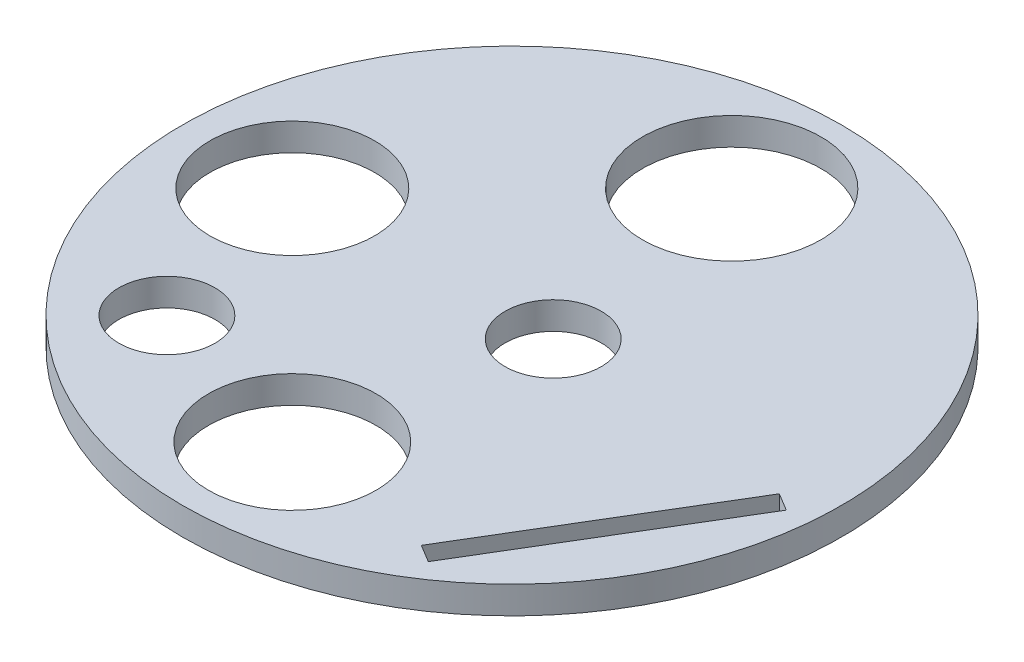
from build123d import *

# Parameters (mm, degrees)
ESQUISSE1_R        = 24
ESQUISSE1_R_2      = 6.5
ESQUISSE1_R_3      = 6
ESQUISSE1_R_4      = 6.1
ESQUISSE1_R_5      = 3.5
BOSS_EXTRU_1_DEPTH = 2


with BuildPart() as part:
    # Esquisse1 → Boss.-Extru.1 (new body)
    with BuildSketch(Plane(origin=(0, 0, 0), x_dir=(1, 0, 0), z_dir=(0, 1, 0))):
        with Locations(Location((0, 0, 0), (0, 0, 270))):
            Circle(ESQUISSE1_R)
        with Locations(Location((0, 16, 0), (0, 0, 270))):
            Circle(ESQUISSE1_R_2, mode=Mode.SUBTRACT)
        with Locations(Location((-16, 0, 0), (0, 0, 270))):
            Circle(ESQUISSE1_R_3, mode=Mode.SUBTRACT)
        with Locations(Location((0, -16, 0), (0, 0, 270))):
            Circle(ESQUISSE1_R_4, mode=Mode.SUBTRACT)
        with Locations(Location((-12.542919229, -12.586407821, 0), (0, 0, 270))):
            Circle(ESQUISSE1_R_5, mode=Mode.SUBTRACT)
        with Locations(Location((3, 0, 0), (0, 0, 270))):
            Circle(ESQUISSE1_R_5, mode=Mode.SUBTRACT)
        Polygon((21, -1.535055726), (11.214276577, -17.821234439), (12.500027528, -18.593791552), (22.285750951, -2.307612838), align=None, mode=Mode.SUBTRACT)
    extrude(amount=BOSS_EXTRU_1_DEPTH)


solid = part.part
